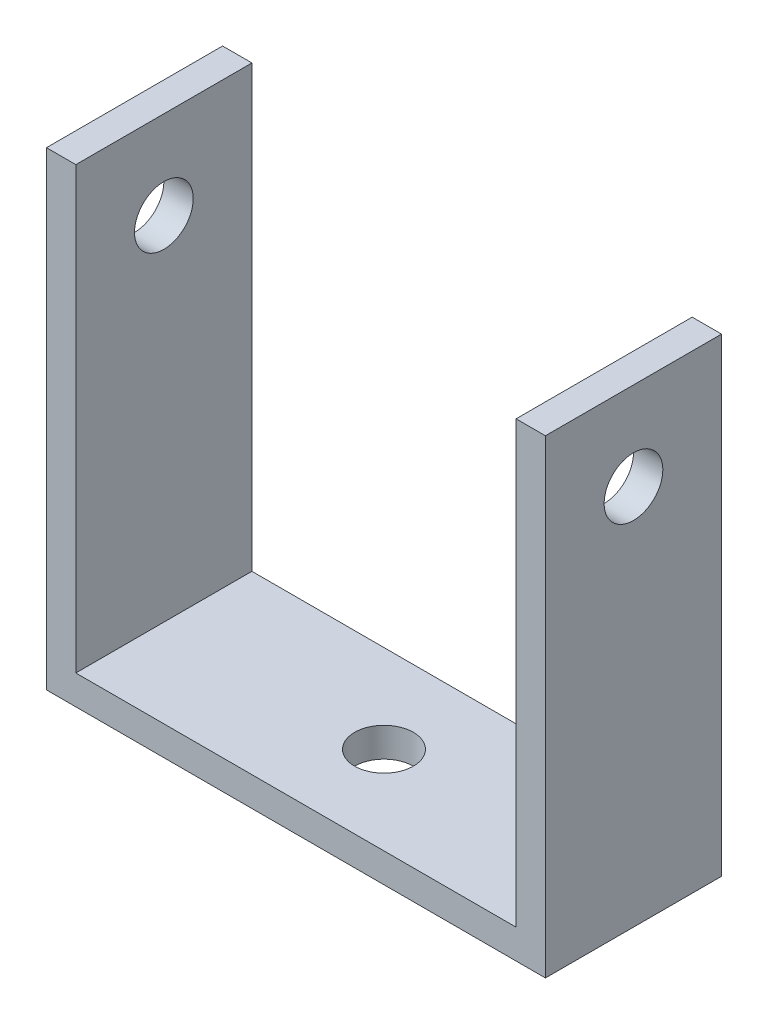
from build123d import *

# Parameters (mm, degrees)
BOSS_EXTRUDE1_DEPTH     = 30
CUT_EXTRUDE1_DEPTH      = 229.691932521
CUT_EXTRUDE1_DEPTH_BACK = 229.691932521
SKETCH2_R               = 10
CUT_EXTRUDE2_DEPTH      = 184.643676722
CUT_EXTRUDE2_DEPTH_BACK = 184.643676722
SKETCH3_R               = 10


with BuildPart() as part:
    # Sketch1 → Boss-Extrude1 (new, symmetric)
    with BuildSketch(Plane.XY):
        Polygon((0, 0), (75, 0), (75, 150), (85, 150), (85, -10), (0, -10), (-85, -10), (-85, 150), (-75, 150), (-75, 0), align=None)
    extrude(amount=BOSS_EXTRUDE1_DEPTH, both=True)

    # Sketch2 → Cut-Extrude1 (cut, two sides: drawn at the far end of the back side and taken through both)
    with BuildSketch(Plane(origin=(85, 0, 0), x_dir=(0, 0, -1), z_dir=(1, 0, 0)).offset(-CUT_EXTRUDE1_DEPTH_BACK)):
        with Locations((0, 120)):
            Circle(SKETCH2_R)
    extrude(amount=CUT_EXTRUDE1_DEPTH + CUT_EXTRUDE1_DEPTH_BACK, mode=Mode.SUBTRACT)

    # Sketch3 → Cut-Extrude2 (cut, two sides: drawn at the far end of the back side and taken through both)
    with BuildSketch(Plane.XZ.offset(10).offset(-CUT_EXTRUDE2_DEPTH_BACK)):
        with Locations(Location((0, 0, 0), (0, 0, 270))):
            Circle(SKETCH3_R)
    extrude(amount=CUT_EXTRUDE2_DEPTH + CUT_EXTRUDE2_DEPTH_BACK, mode=Mode.SUBTRACT)


solid = part.part
